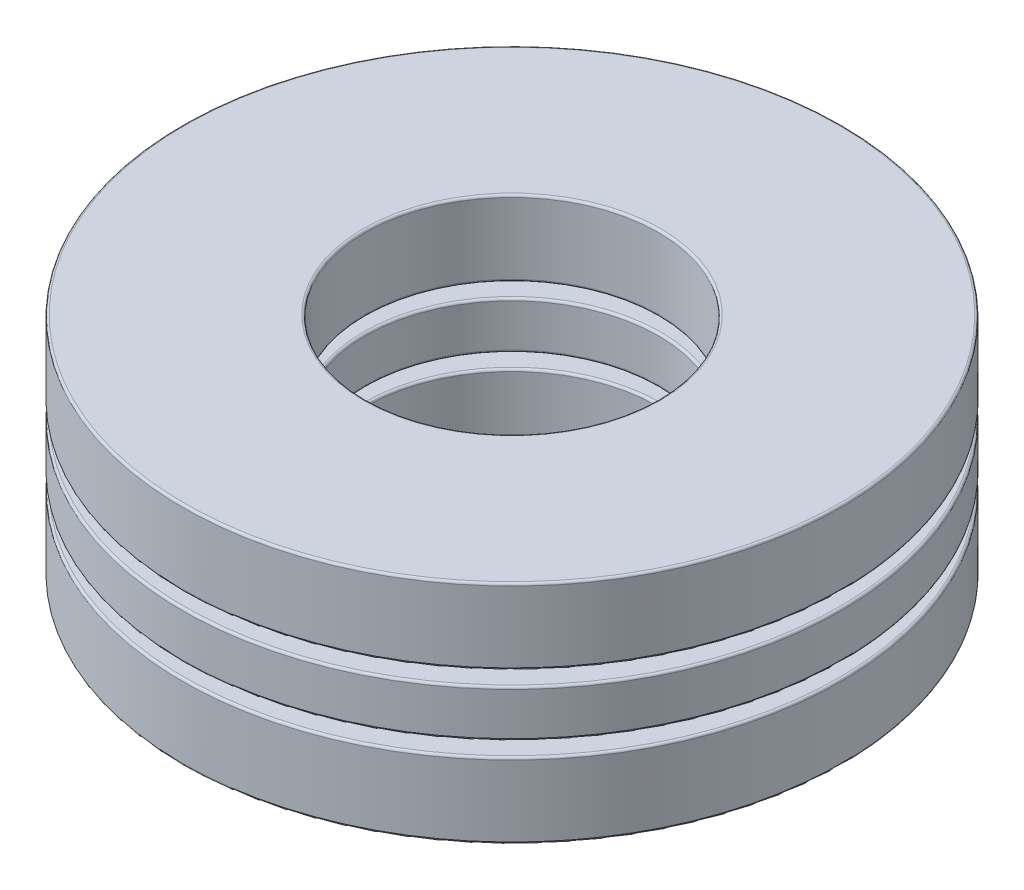
from build123d import *

# Parameters (mm, degrees)
SKETCH1_W         = 3.96875
SKETCH1_H         = 1.021291666
CIRPATTERN1_COUNT = 7
CIRPATTERN1_ANGLE = 308.571428571
CIRPATTERN2_COUNT = 7
SKETCH4_W         = 3.96875
SKETCH4_H         = 1.634066667
FILLET1_R         = 0.049022
FILLET2_R         = 0.049022
FILLET3_R         = 0.049022


with BuildPart() as part:
    # Sketch1 → Revolve1 (revolve)
    with BuildSketch(Plane(origin=(0, 0, 0), x_dir=(0, 0, -1), z_dir=(1, 0, 0)), mode=Mode.PRIVATE) as revolve1_sk:
        with Locations((-5.159375, 0)):
            Rectangle(SKETCH1_W, SKETCH1_H)
    revolve(revolve1_sk.sketch.rotate(Axis((0, -2.4511, 0), (0, 1, 0)), 180), axis=Axis((0, -2.4511, 0), (0, 1, 0)))

    # Sketch3 → Cut-Revolve1 (revolve, cut)
    with BuildSketch(Plane(origin=(0, 0, 0), x_dir=(0, 0, -1), z_dir=(1, 0, 0))):
        with BuildLine():
            Line((-5.159375, 0.817033333), (-5.159375, -0.817033333))
            ThreePointArc((-5.159375, -0.817033333), (-5.976408333, 0), (-5.159375, 0.817033333))
        make_face()
    cut_revolve1 = revolve(axis=Axis((0, 0.817033333, 5.159375), (0, -1, 0)), mode=Mode.SUBTRACT)

    # CirPattern2: Cut-Revolve1 ×7 about axis
    cirpattern2_axis = Axis((0, 0, 0), (0, 1, 0))
    for i in range(1, CIRPATTERN2_COUNT):
        add(cut_revolve1.rotate(cirpattern2_axis, i * 360 / CIRPATTERN2_COUNT), mode=Mode.SUBTRACT)

    # Fillet2
    fillet2_edges = [part.edges().sort_by_distance(p)[0] for p in [
        (0, 0.510645833, 7.14375),
        (0, 0.510645833, 3.175),
        (0, -0.510645833, 3.175),
        (0, -0.510645833, 7.14375),
    ]]
    fillet(fillet2_edges, radius=FILLET2_R)


with BuildPart() as body_2:
    # Sketch2 → Revolve2 (revolve)
    with BuildSketch(Plane(origin=(0, 0, 0), x_dir=(0, 0, -1), z_dir=(1, 0, 0))):
        with BuildLine():
            Line((-5.159375, 0.817033333), (-5.159375, -0.817033333))
            ThreePointArc((-5.159375, -0.817033333), (-5.976408333, 0), (-5.159375, 0.817033333))
        make_face()
    revolve(axis=Axis((0, 0.817033333, 5.159375), (0, -1, 0)))


with BuildPart() as cirpattern1_1:
    # CirPattern1: pattern copy
    add(body_2.part.rotate(Axis((0, 2.4511, 0), (0, -1, 0)), 1 * CIRPATTERN1_ANGLE / (CIRPATTERN1_COUNT - 1)))


with BuildPart() as cirpattern1_2:
    # CirPattern1: pattern copy
    add(body_2.part.rotate(Axis((0, 2.4511, 0), (0, -1, 0)), 2 * CIRPATTERN1_ANGLE / (CIRPATTERN1_COUNT - 1)))


with BuildPart() as cirpattern1_3:
    # CirPattern1: pattern copy
    add(body_2.part.rotate(Axis((0, 2.4511, 0), (0, -1, 0)), 3 * CIRPATTERN1_ANGLE / (CIRPATTERN1_COUNT - 1)))


with BuildPart() as cirpattern1_4:
    # CirPattern1: pattern copy
    add(body_2.part.rotate(Axis((0, 2.4511, 0), (0, -1, 0)), 4 * CIRPATTERN1_ANGLE / (CIRPATTERN1_COUNT - 1)))


with BuildPart() as cirpattern1_5:
    # CirPattern1: pattern copy
    add(body_2.part.rotate(Axis((0, 2.4511, 0), (0, -1, 0)), 5 * CIRPATTERN1_ANGLE / (CIRPATTERN1_COUNT - 1)))


with BuildPart() as cirpattern1_6:
    # CirPattern1: pattern copy
    add(body_2.part.rotate(Axis((0, 2.4511, 0), (0, -1, 0)), 6 * CIRPATTERN1_ANGLE / (CIRPATTERN1_COUNT - 1)))


with BuildPart() as body_9:
    # Sketch4 → Revolve3 (revolve)
    with BuildSketch(Plane(origin=(0, 0, 0), x_dir=(0, 0, -1), z_dir=(1, 0, 0)), mode=Mode.PRIVATE) as revolve3_sk:
        with Locations((-5.159375, 1.634066667)):
            Rectangle(SKETCH4_W, SKETCH4_H)
        with Locations((-5.159375, -1.634066667)):
            Rectangle(SKETCH4_W, SKETCH4_H)
    revolve(revolve3_sk.sketch.rotate(Axis((0, -2.4511, 0), (0, 1, 0)), 180), axis=Axis((0, -2.4511, 0), (0, 1, 0)))

    # Fillet1
    fillet1_edges = [body_9.edges().sort_by_distance(p)[0] for p in [
        (0, 0.817033333, 7.14375),
        (0, 0.817033333, 3.175),
        (0, 2.4511, 3.175),
        (0, 2.4511, 7.14375),
    ]]
    fillet(fillet1_edges, radius=FILLET1_R)

    # Fillet3
    fillet3_edges = [body_9.edges().sort_by_distance(p)[0] for p in [
        (0, -2.4511, 7.14375),
        (0, -2.4511, 3.175),
        (0, -0.817033333, 3.175),
        (0, -0.817033333, 7.14375),
    ]]
    fillet(fillet3_edges, radius=FILLET3_R)


solid = Compound([part.part, body_2.part, cirpattern1_1.part, cirpattern1_2.part, cirpattern1_3.part, cirpattern1_4.part, cirpattern1_5.part, cirpattern1_6.part, body_9.part])
